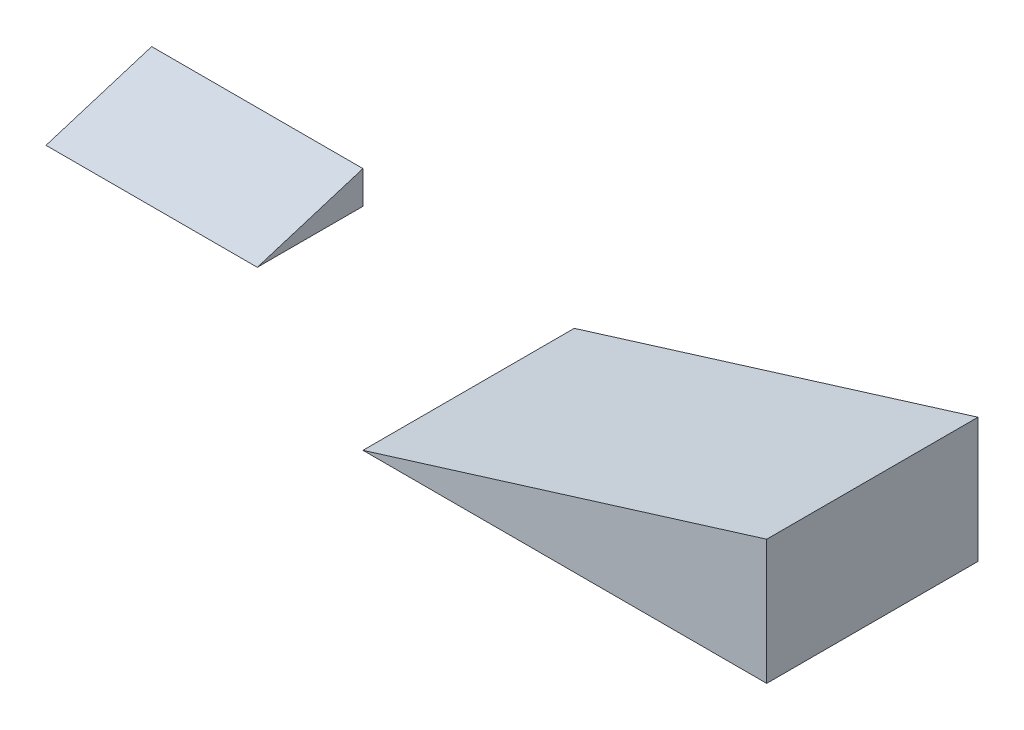
from build123d import *

# Parameters (mm, degrees)
EXTRUDE_1_DEPTH = 50
EXTRUDE_2_DEPTH = 50


with BuildPart() as part:
    # 草图2 → 凸台-拉伸1 (new body)
    with BuildSketch(Plane.XY):
        Polygon((195.533648913, 29.552020666), (100, 0), (195.533648913, 0), align=None)
    extrude(amount=EXTRUDE_1_DEPTH)


with BuildPart() as body_2:
    # 草图3 → 凸台-拉伸2 (new body)
    with BuildSketch(Plane(origin=(0, 0, 0), x_dir=(0, 0, -1), z_dir=(1, 0, 0))):
        Polygon((0, 0), (0, 7.73340624), (-25, 0), align=None)
    extrude(amount=EXTRUDE_2_DEPTH)


solid = Compound([part.part, body_2.part])
